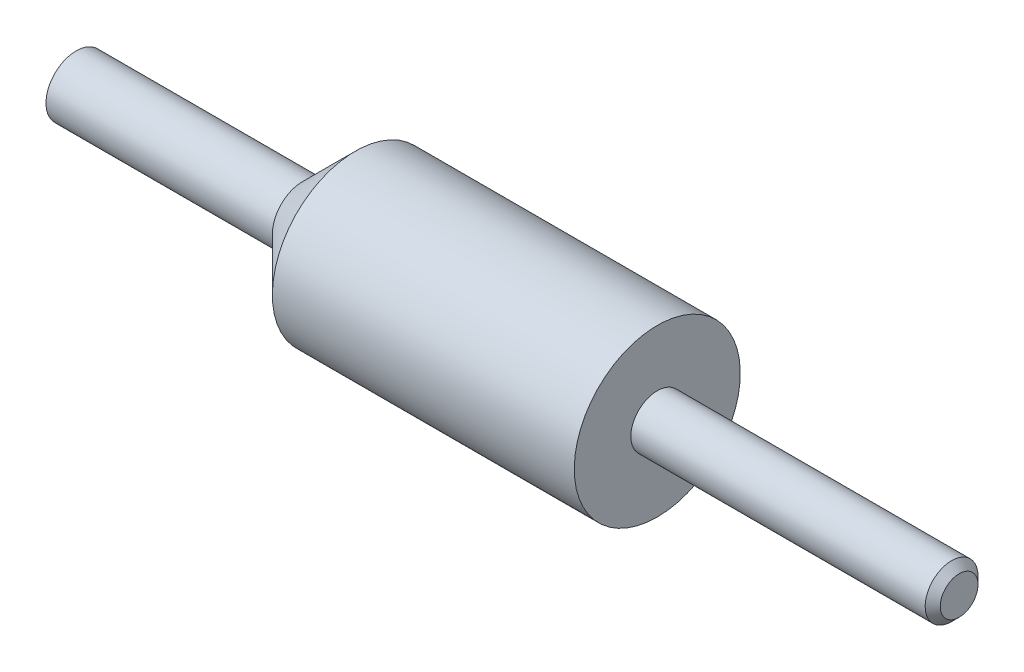
from build123d import *

# Parameters (mm, degrees)
CHAMFER1_SIZE = 0.5


with BuildPart() as part:
    # Sketch1 → Revolve1 (revolve)
    with BuildSketch(Plane.XY, mode=Mode.PRIVATE) as revolve1_sk:
        Polygon((-58.5, 0), (0, 0), (0, 1.75), (-20, 1.75), (-20, 5.5), (-40, 5.5), (-43.5, 2), (-58.5, 2), align=None)
    revolve(revolve1_sk.sketch.rotate(Axis((-58.5, 0, 0), (1, 0, 0)), 180), axis=Axis((-58.5, 0, 0), (1, 0, 0)))

    # Chamfer1
    chamfer1_edges = [part.edges().sort_by_distance(p)[0] for p in [
        (0, 1.75, 0),
    ]]
    chamfer(chamfer1_edges, length=CHAMFER1_SIZE)


solid = part.part
